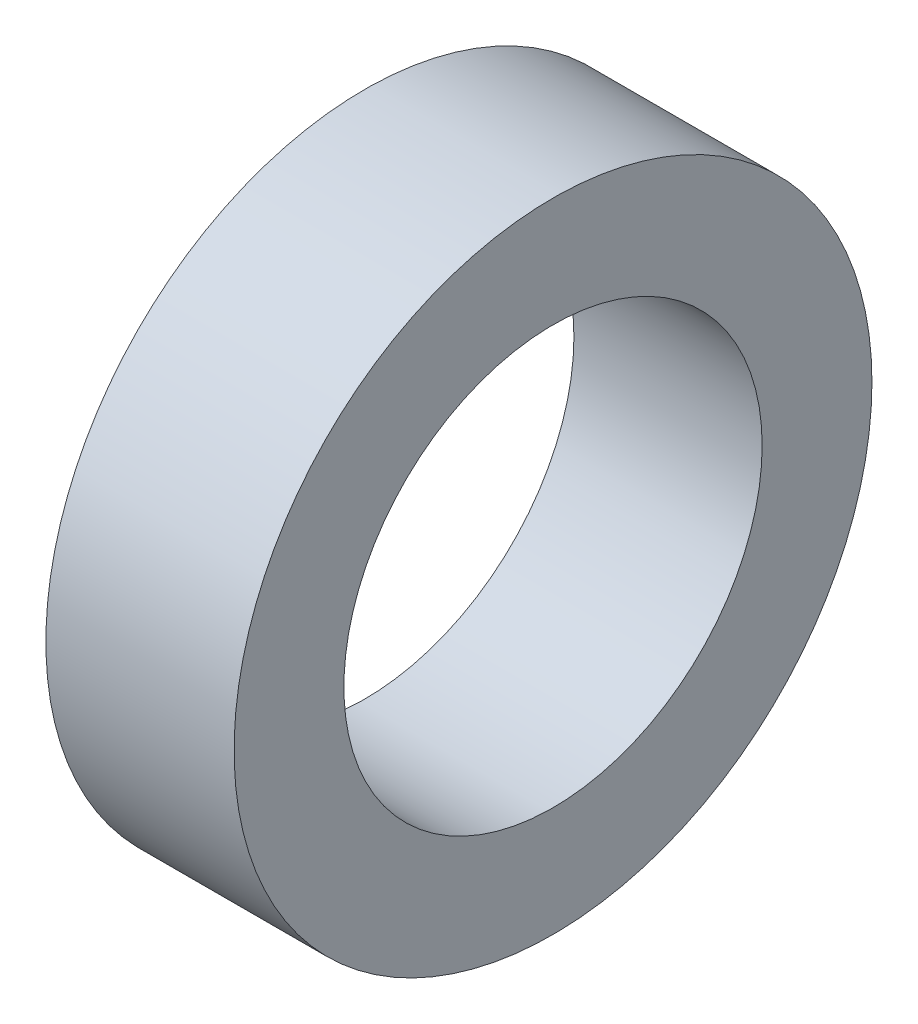
from build123d import *

# Parameters (mm, degrees)
SKETCH1_R           = 6.1
SKETCH1_R_2         = 4
BOSS_EXTRUDE1_DEPTH = 3.6


with BuildPart() as part:
    # Sketch1 → Boss-Extrude1 (new body)
    with BuildSketch(Plane(origin=(0, 0, 0), x_dir=(0, 0, -1), z_dir=(1, 0, 0))):
        Circle(SKETCH1_R)
        Circle(SKETCH1_R_2, mode=Mode.SUBTRACT)
    extrude(amount=BOSS_EXTRUDE1_DEPTH)


solid = part.part
